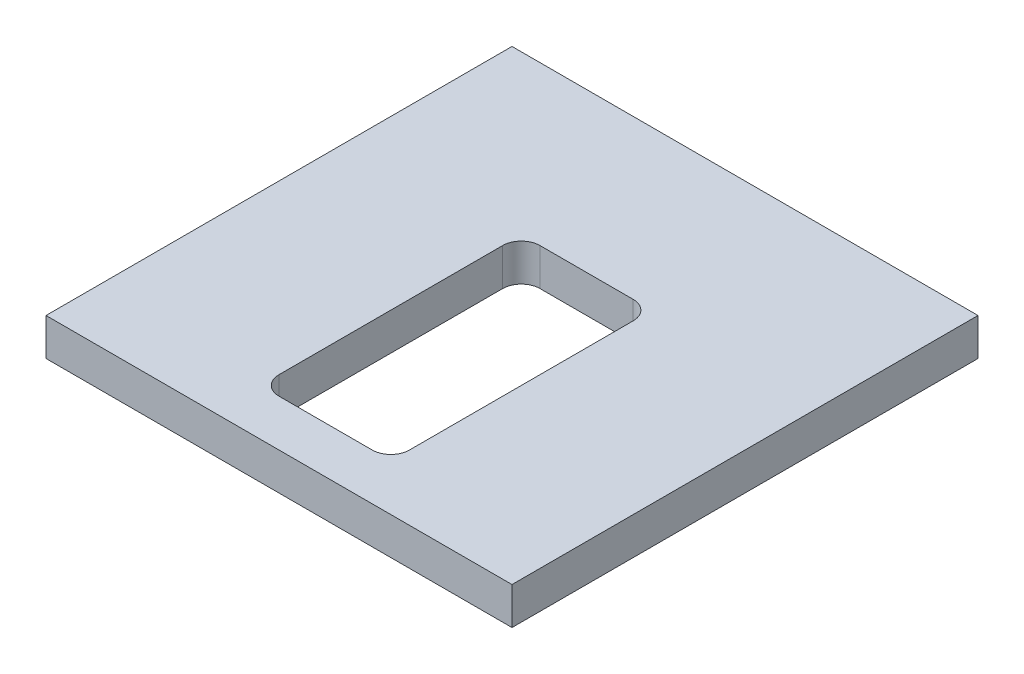
from build123d import *

# Parameters (mm, degrees)
SKETCH1_W           = 25
SKETCH1_H           = 25
BOSS_EXTRUDE1_DEPTH = 1
CUT_EXTRUDE1_REACH  = 19.79
SKETCH2_W           = 7
SKETCH2_H           = 14
FILLET1_R           = 1


with BuildPart() as part:
    # Sketch1 → Boss-Extrude1 (new, symmetric)
    with BuildSketch(Plane(origin=(0, 0, 0), x_dir=(1, 0, 0), z_dir=(0, 1, 0))):
        Rectangle(SKETCH1_W, SKETCH1_H)
    extrude(amount=BOSS_EXTRUDE1_DEPTH, both=True)

    # Sketch2 → Cut-Extrude1 (cut, up to next)
    with BuildSketch(Plane(origin=(0, 1, 0), x_dir=(1, 0, 0), z_dir=(0, 1, 0)), mode=Mode.PRIVATE) as cut_extrude1_sk1:
        with Locations((0, -3)):
            Rectangle(SKETCH2_W, SKETCH2_H)
    cut_extrude1_tool1 = extrude(cut_extrude1_sk1.sketch, amount=-CUT_EXTRUDE1_REACH, mode=Mode.PRIVATE) & part.part
    add(cut_extrude1_tool1.solids().sort_by_distance((0, 1, 3))[0], mode=Mode.SUBTRACT)

    # Fillet1
    fillet1_edges = [part.edges().sort_by_distance(p)[0] for p in [
        (-3.5, 0, 10),
        (-3.5, 0, -4),
        (3.5, 0, -4),
        (3.5, 0, 10),
    ]]
    fillet(fillet1_edges, radius=FILLET1_R)


solid = part.part
